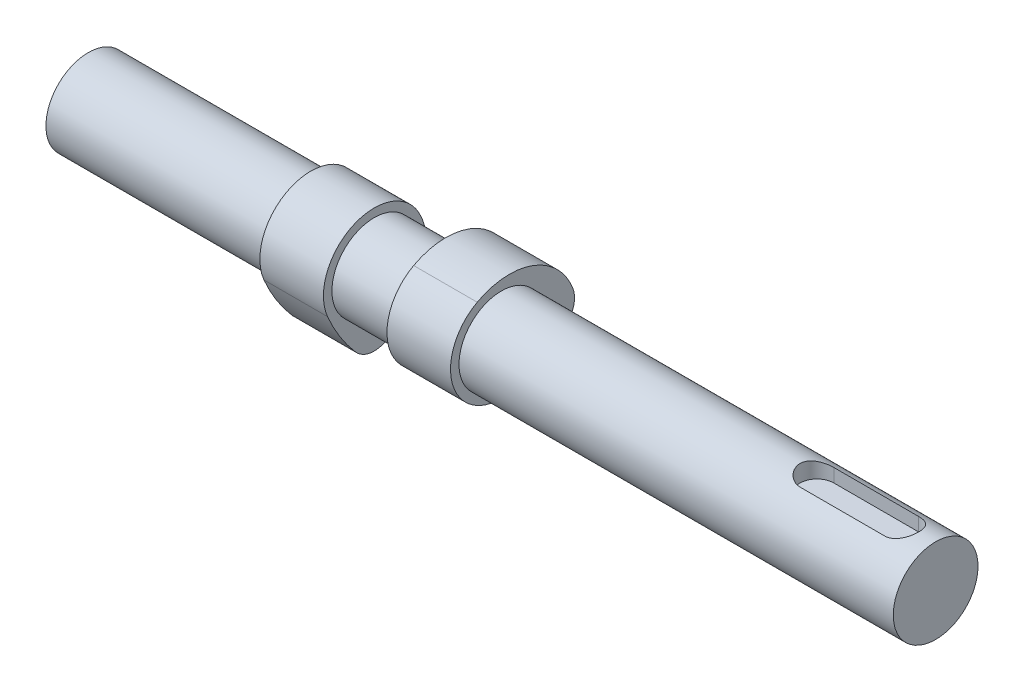
from build123d import *

# Parameters (mm, degrees)
BOSS_EXTRUDE1_DEPTH      = 125
BOSS_EXTRUDE1_DEPTH_BACK = 75
SKETCH1_R                = 10
BOSS_EXTRUDE2_START      = 15
BOSS_EXTRUDE2_DEPTH      = 7.5
BODY_MOVE_COPY1_ANGLE    = 90
CUT_EXTRUDE1_DEPTH       = 4


with BuildPart() as part:
    # Sketch1 → Boss-Extrude1 (new, two sides: drawn at the far end of the back side and taken through both)
    with BuildSketch(Plane(origin=(0, 0, 0), x_dir=(0, 0, -1), z_dir=(1, 0, 0)).offset(-BOSS_EXTRUDE1_DEPTH_BACK)):
        Circle(SKETCH1_R)
    extrude(amount=BOSS_EXTRUDE1_DEPTH + BOSS_EXTRUDE1_DEPTH_BACK)

    # Sketch3 → Cut-Extrude1 (cut)
    with BuildSketch(Plane(origin=(0, 10, 0), x_dir=(1, 0, 0), z_dir=(0, 1, 0))):
        with BuildLine():
            Line((117, -4), (97, -4))
            ThreePointArc((97, -4), (93, 0), (97, 4))
            Line((97, 4), (117, 4))
            ThreePointArc((117, 4), (121, 0), (117, -4))
        make_face()
    extrude(amount=-CUT_EXTRUDE1_DEPTH, mode=Mode.SUBTRACT)


with BuildPart() as body_2:
    # Sketch2 → Boss-Extrude2 (new, symmetric)
    with BuildSketch(Plane(origin=(0, 0, 0), x_dir=(0, 0, -1), z_dir=(1, 0, 0)).offset(BOSS_EXTRUDE2_START)):
        with BuildLine():
            ThreePointArc((-5.702512036, 10.558473208), (-10.805824842, -5.218634829), (4.724055073, -11.031015532))
            ThreePointArc((4.724055073, -11.031015532), (10.25419488, -8.132628826), (15.265932902, -4.408978227))
            ThreePointArc((15.265932902, -4.408978227), (17.089577392, -1.44606998), (16.908216525, 2.028352669))
            ThreePointArc((16.908216525, 2.028352669), (7.548461042, 11.450624047), (-5.702512036, 10.558473208))
        make_face()
    extrude(amount=BOSS_EXTRUDE2_DEPTH, both=True)


with BuildPart() as body_3:
    # Mirror1: mirrored copy
    add(body_2.part.mirror(Plane(origin=(0, 0, 0), x_dir=(0, 0, 1), z_dir=(1, 0, 0))))


with BuildPart() as body_3_1:
    # Body-Move/Copy1: moved
    add(body_3.part.rotate(Axis((0, 0, 0), (-1, 0, 0)), BODY_MOVE_COPY1_ANGLE))


solid = Compound([part.part, body_2.part, body_3_1.part])
